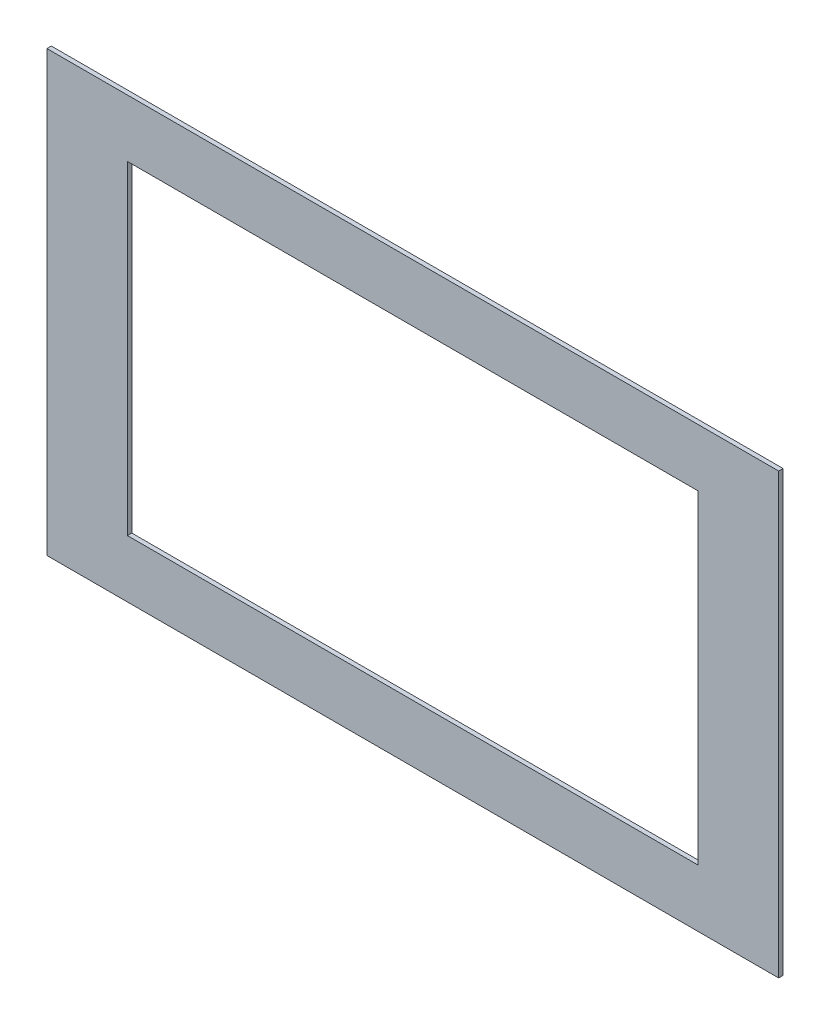
from build123d import *

# Parameters (mm, degrees)
SKETCH1_W      = 250
SKETCH1_H      = 150
EXTRUDE1_DEPTH = 1.5
SKETCH2_W      = 195
SKETCH2_H      = 110.7
EXTRUDE2_DEPTH = 1.5


with BuildPart() as part:
    # Sketch1 → Extrude1 (new body)
    with BuildSketch(Plane.XY):
        Rectangle(SKETCH1_W, SKETCH1_H)
    extrude(amount=EXTRUDE1_DEPTH)

    # Sketch2 → Extrude2 (cut)
    with BuildSketch(Plane.XY.offset(1.5)):
        Rectangle(SKETCH2_W, SKETCH2_H)
    extrude(amount=-EXTRUDE2_DEPTH, mode=Mode.SUBTRACT)


solid = part.part
